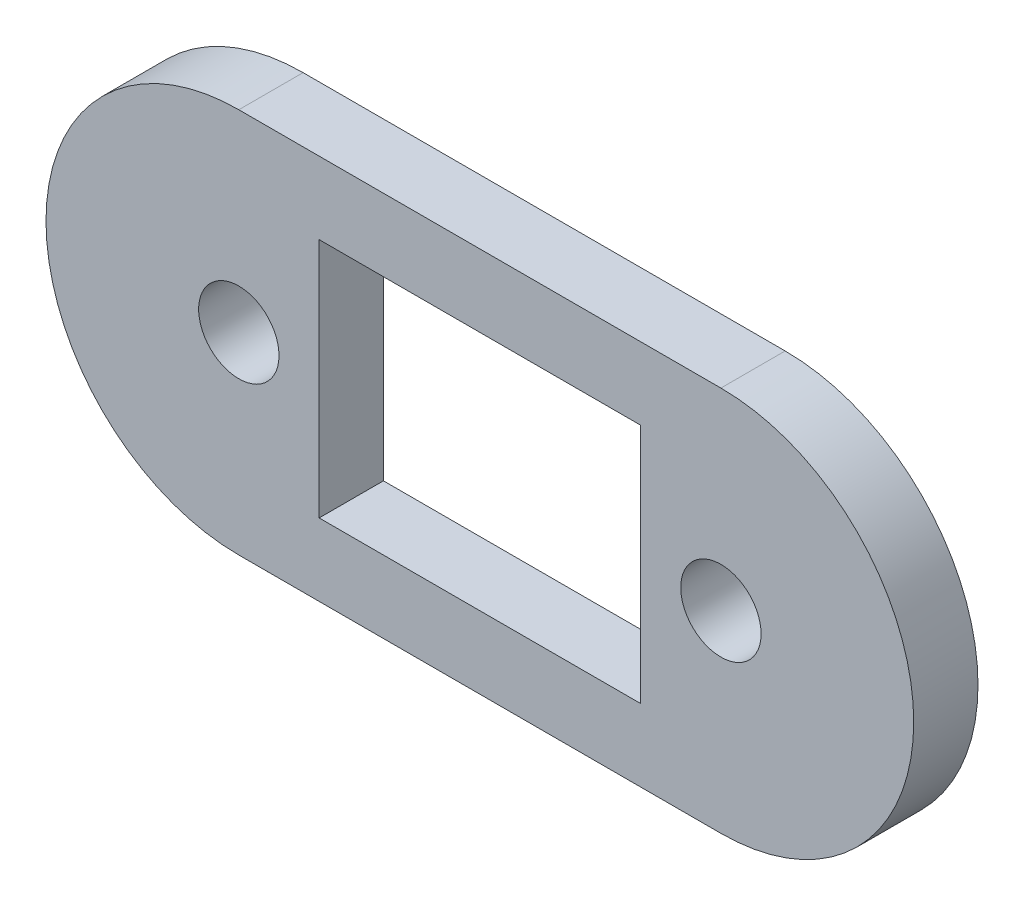
from build123d import *

# Parameters (mm, degrees)
SKETCH1_R           = 12.5
SKETCH1_W           = 100
SKETCH1_H           = 75
BOSS_EXTRUDE1_DEPTH = 20


with BuildPart() as part:
    # Sketch1 → Boss-Extrude1 (new body)
    with BuildSketch(Plane.XY):
        with BuildLine():
            Line((-75, 60), (75, 60))
            ThreePointArc((75, 60), (135, 0), (75, -60))
            Line((75, -60), (-75, -60))
            ThreePointArc((-75, -60), (-135, 0), (-75, 60))
        make_face()
        with Locations((75, 0)):
            Circle(SKETCH1_R, mode=Mode.SUBTRACT)
        with Locations((-75, 0)):
            Circle(SKETCH1_R, mode=Mode.SUBTRACT)
        Rectangle(SKETCH1_W, SKETCH1_H, mode=Mode.SUBTRACT)
    extrude(amount=BOSS_EXTRUDE1_DEPTH)


solid = part.part
